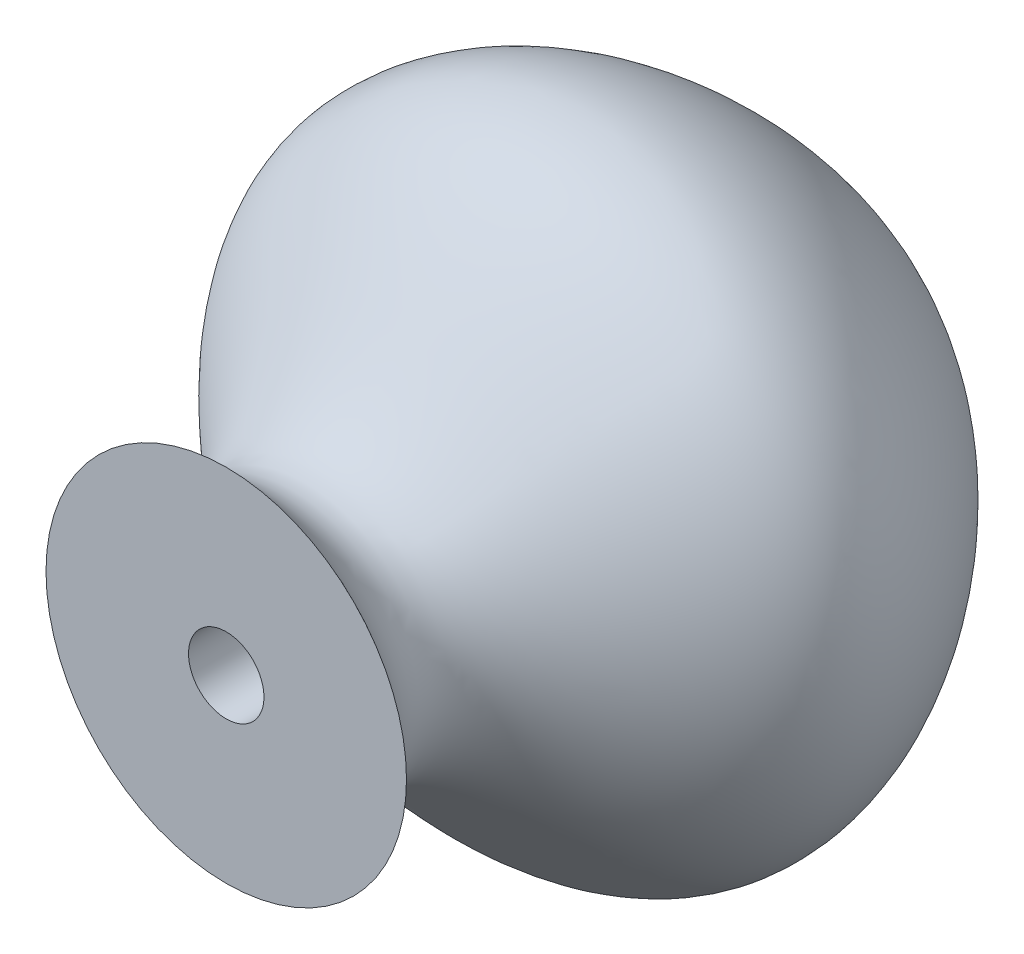
from build123d import *

# Parameters (mm, degrees)
SKETCH_2_R          = 2
CUT_EXTRUDE_1_DEPTH = 5


with BuildPart() as part:
    # 草图1 → 旋转7 (revolve)
    with BuildSketch(Plane(origin=(0, 0, 0), x_dir=(1, 0, 0), z_dir=(0, 1, 0))):
        with BuildLine():
            Line((0, 16.5), (0, -16.5))
            Line((0, -16.5), (9.554258725, -16.5))
            add(Edge.make_bspline(
                [(0, 16.5), (7.158704266, 18.146356566), (22.205045429, 3.949682041), (10.615105351, -7.390019425), (3.866724955, -12.664134051), (9.554258725, -16.5)],
                knots=[0, 0, 0, 0, 0.549518939, 0.720750842, 1, 1, 1, 1], degree=3))
        make_face()
    revolve(axis=Axis((0, 0, -16.5), (0, 0, 1)))

    # 草图2 → 切除-拉伸1 (cut)
    with BuildSketch(Plane.XY.offset(16.5)):
        Circle(SKETCH_2_R)
    extrude(amount=-CUT_EXTRUDE_1_DEPTH, mode=Mode.SUBTRACT)


solid = part.part
